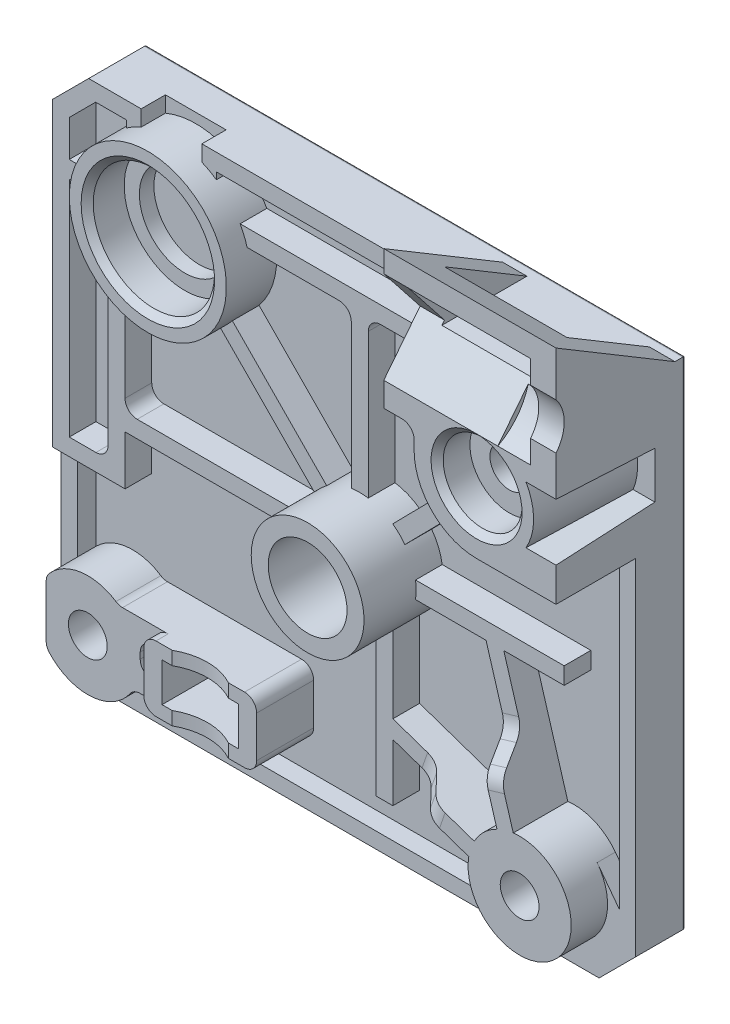
from build123d import *
from build123d.topology import SkipClean

# Parameters (mm, degrees)
SKETCH_1_W                  = 47.38
SKETCH_1_H                  = 43.88
EXTRUDE_1_DEPTH             = 3.2
EXTRUDE_3_DEPTH             = 9
SKETCH_36_W                 = 9.3
SKETCH_36_H                 = 4.1
CUT_EXTRUDE_15_DEPTH        = 3.6
SKETCH_8_R                  = 1.6
CUT_EXTRUDE_4_DEPTH         = 16.67
SKETCH_9_R                  = 1.6
EXTRUDE_4_DEPTH             = 7.45
EXTRUDE_4_DIRECTION_2_REACH = 34.548
CUT_EXTRUDE_16_DEPTH        = 14.2
SKETCH_10_R                 = 3.25
CUT_EXTRUDE_5_DEPTH         = 2.7
EXTRUDE_START               = 3.1
SKETCH_15_R                 = 4.25
SKETCH_15_R_2               = 1.6
EXTRUDE_5_DEPTH             = 3.1
SKETCH_17_R                 = 4.65
EXTRUDE_6_DEPTH             = 5.9
SKETCH_18_R                 = 6.475
EXTRUDE_7_DEPTH             = 3.55
EXTRUDE_START_2             = 0.8
SKETCH_38_R                 = 4.25
SKETCH_38_R_2               = 1.6
EXTRUDE_8_DEPTH             = 0.8
EXTRUDE_START_3             = 1.6
SKETCH_39_R                 = 1.6
EXTRUDE_9_DEPTH             = 1.6
SKETCH_19_R                 = 5
CUT_EXTRUDE_11_DEPTH        = 3.05
SKETCH_20_R                 = 3.75
CUT_EXTRUDE_12_DEPTH        = 1.2
CHAMFER_2_SIZE              = 0.5
CHAMFER_3_SIZE              = 3
FILLET_4_R                  = 1
SKETCH_23_R                 = 2.925
CUT_EXTRUDE_14_DEPTH        = 2.85
SKETCH_40_R                 = 3.25
CUT_EXTRUDE_17_DEPTH        = 38.648667971
CUT_EXTRUDE_18_DEPTH        = 12.1
SKETCH_43_W                 = 10.1
SKETCH_43_H                 = 4.07
CUT_EXTRUDE_19_DEPTH        = 39.053051126
SKETCH_45_R                 = 3
CUT_EXTRUDE_20_DEPTH        = 55.194990543
CUT_EXTRUDE_21_DEPTH        = 2.7
CUT_EXTRUDE_22_DEPTH        = 8.15
DRAFT_1_ANGLE               = 3
CUT_EXTRUDE_START           = -3.95
CUT_EXTRUDE_23_DEPTH        = 3.95
CUT_EXTRUDE_START_2         = -2.2
CUT_EXTRUDE_24_DEPTH        = 2.2
FILLET_5_R                  = 1
SKETCH_50_W                 = 6.3
SKETCH_50_H                 = 3.2
CUT_EXTRUDE_25_DEPTH        = 4.7
CUT_EXTRUDE_26_DEPTH        = 3.7
CUT_EXTRUDE_START_3         = -0.7
CUT_EXTRUDE_27_DEPTH        = 0.7
EXTRUDE_11_DEPTH            = 1.4
EXTRUDE_12_DEPTH            = 1.4
FILLET_6_R                  = 2
FILLET_7_R                  = 0.2
EXTRUDE_13_DEPTH            = 0.15
EXTRUDE_14_DEPTH            = 0.15
CUT_EXTRUDE_28_DEPTH        = 4.8
SKETCH_58_R                 = 1.6
CUT_EXTRUDE_29_DEPTH        = 38.3557519


with BuildPart() as part:
    # Эскиз1 → Бобышка-Вытянуть1 (new body)
    with BuildSketch(Plane.XY):
        Rectangle(SKETCH_1_W, SKETCH_1_H)
    extrude(amount=EXTRUDE_1_DEPTH)

    # Эскиз3 → Бобышка-Вытянуть3 (add)
    with BuildSketch(Plane.XZ.offset(21.94)):
        with BuildLine():
            Line((-13.64, 0), (-13.64, 7.3))
            Line((-13.64, 7.3), (-11.313790008, 7.3))
            ThreePointArc((-11.313790008, 7.3), (-8.99, 6.7), (-6.666209992, 7.3))
            Line((-6.666209992, 7.3), (-4.34, 7.3))
            Line((-4.34, 7.3), (-4.34, 0))
            Line((-4.34, 0), (-13.64, 0))
        make_face()
    extrude(amount=-EXTRUDE_3_DEPTH)

    # Эскиз36 → Вырез-Вытянуть15 (cut)
    with BuildSketch(Plane.XZ.offset(21.94)):
        with Locations((-8.99, 5.25)):
            Rectangle(SKETCH_36_W, SKETCH_36_H)
    extrude(amount=-CUT_EXTRUDE_15_DEPTH, mode=Mode.SUBTRACT)

    # Эскиз8 → Вырез-Вытянуть4 (cut)
    with BuildSketch(Plane.XY.offset(3.2)):
        with Locations((-19.26, -16.34)):
            Circle(SKETCH_8_R)
        with Locations((17.14, -16.34)):
            Circle(SKETCH_8_R)
        with Locations((17.14, 14.66)):
            Circle(SKETCH_8_R)
    extrude(amount=-CUT_EXTRUDE_4_DEPTH, mode=Mode.SUBTRACT)

    # Эскиз9 → Бобышка-Вытянуть4 (add)
    with BuildSketch(Plane.XY.offset(3.2)):
        with BuildLine():
            Line((17.14, 9.51), (23.69, 9.51))
            Line((23.69, 9.51), (23.69, 27.81))
            Line((23.69, 27.81), (9.49, 27.81))
            Line((9.49, 27.81), (9.49, 16.41))
            Line((9.49, 16.41), (10.99, 16.41))
            ThreePointArc((10.99, 16.41), (11.697106781, 16.117106781), (11.99, 15.41))
            Line((11.99, 15.41), (11.99, 14.66))
            ThreePointArc((11.99, 14.66), (13.498400077, 11.018400077), (17.14, 9.51))
        make_face()
        with Locations((17.14, 14.66)):
            Circle(SKETCH_9_R, mode=Mode.SUBTRACT)
    extrude(amount=EXTRUDE_4_DEPTH)

    # Бобышка-Вытянуть4 direction 2: up to this face of the body (flat: up to its plane)
    extrude_4_direction_2_end = Plane(part.part.faces().sort_by_distance((-0.058785147, 0.070526521, 0))[0])
    # Эскиз9 → Бобышка-Вытянуть4 direction 2 (add, up to the picked face)
    with BuildSketch(Plane.XY.offset(3.2), mode=Mode.PRIVATE) as extrude_4_direction_2_sk1:
        with BuildLine():
            Line((17.14, 9.51), (23.69, 9.51))
            Line((23.69, 9.51), (23.69, 27.81))
            Line((23.69, 27.81), (9.49, 27.81))
            Line((9.49, 27.81), (9.49, 16.41))
            Line((9.49, 16.41), (10.99, 16.41))
            ThreePointArc((10.99, 16.41), (11.697106781, 16.117106781), (11.99, 15.41))
            Line((11.99, 15.41), (11.99, 14.66))
            ThreePointArc((11.99, 14.66), (13.498400077, 11.018400077), (17.14, 9.51))
        make_face()
        with Locations((17.14, 14.66)):
            Circle(SKETCH_9_R, mode=Mode.SUBTRACT)
    extrude_4_direction_2_tool1 = split(extrude(extrude_4_direction_2_sk1.sketch, amount=-EXTRUDE_4_DIRECTION_2_REACH, mode=Mode.PRIVATE), bisect_by=extrude_4_direction_2_end, keep=Keep.BOTH, mode=Mode.PRIVATE)
    add(extrude_4_direction_2_tool1.solids().sort_by(Axis((17.092373, 19.426057, 3.2), (0, 0, -1)))[0])

    # Эскиз37 → Вырез-Вытянуть16 (cut)
    with BuildSketch(Plane(origin=(23.69, 0, 0), x_dir=(0, 0, -1), z_dir=(1, 0, 0))):
        Polygon((-10.65, 27.81), (-0.85, 21.94), (0, 21.94), (0, 27.81), align=None)
    extrude(amount=-CUT_EXTRUDE_16_DEPTH, mode=Mode.SUBTRACT)

    # Эскиз10 → Вырез-Вытянуть5 (cut)
    with BuildSketch(Plane.XY.offset(10.65)):
        with Locations((17.14, 14.66)):
            Circle(SKETCH_10_R)
    extrude(amount=-CUT_EXTRUDE_5_DEPTH, mode=Mode.SUBTRACT)

    # Эскиз15 → Бобышка-Вытянуть5 (add)
    # profile 1 of 2: a face of its own
    with BuildSketch(Plane.XY.offset(3.2).offset(EXTRUDE_START)):
        with Locations(Location((17.14, -16.34, 0), (0, 0, 180))):
            Circle(SKETCH_15_R)
        with Locations(Location((17.14, -16.34, 0), (0, 0, 180))):
            Circle(SKETCH_15_R_2, mode=Mode.SUBTRACT)
    # profile 2 of 2: a face of its own
    with BuildSketch(Plane.XY.offset(3.2).offset(EXTRUDE_START)):
        with BuildLine():
            Line((-16.71, -12.94), (-13.64, -12.94))
            Line((-13.64, -12.94), (-13.64, -18.34))
            Line((-13.64, -18.34), (-15.51, -18.34))
            ThreePointArc((-15.51, -18.34), (-18.95917105, -20.5793398), (-22.69, -18.849501943))
            Line((-22.69, -18.849501943), (-22.69, -13.830498057))
            ThreePointArc((-22.69, -13.830498057), (-19.885976595, -12.136352381), (-16.71, -12.94))
        make_face()
        with Locations(Location((-19.26, -16.34, 0), (0, 0, 180))):
            Circle(SKETCH_15_R_2, mode=Mode.SUBTRACT)
    extrude(amount=-EXTRUDE_5_DEPTH)

    # Эскиз17 → Бобышка-Вытянуть6 (add)
    with BuildSketch(Plane.XY.offset(3.2)):
        with Locations(Location((1.66, -1.09, 0), (0, 0, 180))):
            Circle(SKETCH_17_R)
    extrude(amount=EXTRUDE_6_DEPTH)

    # Эскиз18 → Бобышка-Вытянуть7 (add)
    with BuildSketch(Plane.XY.offset(3.2)):
        with Locations(Location((-13.86, 14.66, 0), (0, 0, 180))):
            Circle(SKETCH_18_R)
    extrude(amount=EXTRUDE_7_DEPTH)

    # Эскиз38 → Бобышка-Вытянуть8 (add)
    with BuildSketch(Plane.XY.offset(6.3).offset(EXTRUDE_START_2)):
        with Locations(Location((17.14, -16.34, 0), (0, 0, 180))):
            Circle(SKETCH_38_R)
        with Locations(Location((17.14, -16.34, 0), (0, 0, 180))):
            Circle(SKETCH_38_R_2, mode=Mode.SUBTRACT)
    extrude(amount=-EXTRUDE_8_DEPTH)

    # Эскиз39 → Бобышка-Вытянуть9 (add)
    # profile 1 of 2: a face of its own
    with BuildSketch(Plane.XY.offset(3.2).offset(EXTRUDE_START_3)):
        with Locations((17.14, 14.66)):
            Circle(SKETCH_39_R)
    # profile 2 of 2: a face of its own
    with BuildSketch(Plane.XY.offset(3.2).offset(EXTRUDE_START_3)):
        with BuildLine():
            Line((9.49, 16.41), (9.49, 21.94))
            Line((9.49, 21.94), (-23.69, 21.94))
            Line((-23.69, 21.94), (-23.69, -21.94))
            Line((-23.69, -21.94), (23.69, -21.94))
            Line((23.69, -21.94), (23.69, 9.51))
            Line((23.69, 9.51), (17.14, 9.51))
            ThreePointArc((17.14, 9.51), (13.498400077, 11.018400077), (11.99, 14.66))
            Line((11.99, 14.66), (11.99, 15.41))
            ThreePointArc((11.99, 15.41), (11.697106781, 16.117106781), (10.99, 16.41))
            Line((10.99, 16.41), (9.49, 16.41))
        make_face()
        with Locations(Location((17.14, -16.34, 0), (0, 0, 180))):
            Circle(SKETCH_39_R, mode=Mode.SUBTRACT)
        with Locations(Location((-19.26, -16.34, 0), (0, 0, 180))):
            Circle(SKETCH_39_R, mode=Mode.SUBTRACT)
    extrude(amount=-EXTRUDE_9_DEPTH)

    # Эскиз19 → Вырез-Вытянуть11 (cut)
    with BuildSketch(Plane.XY.offset(6.75)):
        with Locations((-13.86, 14.66)):
            Circle(SKETCH_19_R)
    extrude(amount=-CUT_EXTRUDE_11_DEPTH, mode=Mode.SUBTRACT)

    # Эскиз20 → Вырез-Вытянуть12 (cut)
    with BuildSketch(Plane.XY.offset(3.7)):
        with Locations((-13.86, 14.66)):
            Circle(SKETCH_20_R)
    extrude(amount=-CUT_EXTRUDE_12_DEPTH, mode=Mode.SUBTRACT)

    # Фаска2
    chamfer_2_edges = [part.edges().sort_by_distance(p)[0] for p in [
        (13.89, 14.66, 10.65),
        (-18.86, 14.66, 6.75),
    ]]
    chamfer(chamfer_2_edges, length=CHAMFER_2_SIZE)

    # Фаска3
    chamfer_3_edges = [part.edges().sort_by_distance(p)[0] for p in [
        (23.69, -21.94, 2.4),
        (-23.69, -21.94, 2.4),
        (-23.69, 21.94, 2.4),
    ]]
    chamfer(chamfer_3_edges, length=CHAMFER_3_SIZE)

    # Скругление4
    fillet_4_edges = [part.edges().sort_by_distance(p)[0] for p in [
        (-13.64, -18.34, 6.8),
        (-15.51, -18.34, 5.55),
        (-16.71, -12.94, 5.55),
        (-22.69, -13.830498057, 5.55),
        (-22.69, -18.849501943, 5.55),
        (-13.64, -12.94, 6.8),
        (-4.34, -12.94, 6.05),
        (-4.34, -18.34, 6.05),
    ]]
    fillet(fillet_4_edges, radius=FILLET_4_R)

    # Эскиз23 → Вырез-Вытянуть14 (cut)
    with BuildSketch(Plane(origin=(0, 0, 0), x_dir=(-1, 0, 0), z_dir=(0, 0, -1))):
        with Locations((-17.14, 14.66)):
            Circle(SKETCH_23_R)
        with Locations((-17.14, -16.34)):
            Circle(SKETCH_23_R)
        with Locations((19.26, -16.34)):
            Circle(SKETCH_23_R)
    extrude(amount=-CUT_EXTRUDE_14_DEPTH, mode=Mode.SUBTRACT)

    # Эскиз40 → Вырез-Вытянуть17 (cut, through all)
    with BuildSketch(Plane.XY.offset(9.1)):
        with Locations((1.66, -1.09)):
            Circle(SKETCH_40_R)
    extrude(amount=-CUT_EXTRUDE_17_DEPTH, mode=Mode.SUBTRACT)

    # Эскиз42 → Вырез-Вытянуть18 (cut)
    with BuildSketch(Plane.ZY.offset(-9.49)):
        Polygon((10.65, 26.01), (7.65, 22.21), (10.65, 18.41), align=None)
    extrude(amount=-CUT_EXTRUDE_18_DEPTH, mode=Mode.SUBTRACT)

    # Эскиз43 → Вырез-Вытянуть19 (cut, through all)
    with BuildSketch(Plane.XY.offset(10.65)):
        with Locations((16.54, 23.975)):
            Rectangle(SKETCH_43_W, SKETCH_43_H)
    extrude(amount=-CUT_EXTRUDE_19_DEPTH, mode=Mode.SUBTRACT)

    # Эскиз45 → Вырез-Вытянуть20 (cut, through all)
    with BuildSketch(Plane.ZY.offset(-21.59)):
        with Locations((12.971637353, 22.21)):
            Circle(SKETCH_45_R)
    extrude(amount=-CUT_EXTRUDE_20_DEPTH, mode=Mode.SUBTRACT)

    # Эскиз46 → Вырез-Вытянуть21 (cut)
    with BuildSketch(Plane.ZY.offset(-21.59)):
        with BuildLine():
            Line((8.145715431, 21.582093788), (10.65, 18.41))
            ThreePointArc((10.65, 18.41), (9.063078847, 19.731747787), (8.145715431, 21.582093788))
        make_face()
    extrude(amount=CUT_EXTRUDE_21_DEPTH, mode=Mode.SUBTRACT)

    # Эскиз47 → Вырез-Вытянуть22 (cut)
    with BuildSketch(Plane.XY.offset(10.65)):
        with BuildLine():
            Line((21.210319398, 12.31), (23.69, 12.31))
            Line((23.69, 12.31), (23.69, 17.01))
            Line((23.69, 17.01), (21.210319398, 17.01))
            ThreePointArc((21.210319398, 17.01), (21.84, 14.66), (21.210319398, 12.31))
        make_face()
    extrude(amount=-CUT_EXTRUDE_22_DEPTH, mode=Mode.SUBTRACT)

    # Уклон1
    draft_1_faces = [part.faces().sort_by_distance(p)[0] for p in [
        (22.450159699, 17.01, 6.575),
        (21.84, 14.66, 6.575),
        (22.450159699, 12.31, 6.575),
    ]]
    draft(draft_1_faces, Plane.XY.offset(10.65), DRAFT_1_ANGLE)

    # Эскиз48 → Вырез-Вытянуть23 (cut)
    with BuildSketch(Plane.XY.offset(6.75).offset(CUT_EXTRUDE_START)):
        with BuildLine():
            Line((-16.36, 20.632907583), (-16.36, 21.94))
            Line((-16.36, 21.94), (-11.36, 21.94))
            Line((-11.36, 21.94), (-11.36, 20.632907583))
            ThreePointArc((-11.36, 20.632907583), (-13.86, 21.135), (-16.36, 20.632907583))
        make_face()
    extrude(amount=CUT_EXTRUDE_23_DEPTH, mode=Mode.SUBTRACT)

    # Эскиз49 → Вырез-Вытянуть24 (cut)
    with SkipClean():  # the faces are left unmerged after this step: merging them gives an invalid solid
        with BuildSketch(Plane.XY.offset(4.8).offset(CUT_EXTRUDE_START_2)):
            with BuildLine():
                Line((-17.56, 20.54), (-17.56, 19.973720448))
                ThreePointArc((-17.56, 19.973720448), (-19.428801901, 17.963645016), (-20.297050955, 15.36))
                Line((-20.297050955, 15.36), (-22.29, 15.36))
                Line((-22.29, 15.36), (-22.29, 18.360101013))
                Line((-22.29, 18.360101013), (-20.110101013, 20.54))
                Line((-20.110101013, 20.54), (-17.56, 20.54))
            make_face()
            with BuildLine():
                Line((-10.16, 20.54), (-10.16, 19.973720448))
                ThreePointArc((-10.16, 19.973720448), (-9.057980202, 19.003527468), (-8.202869544, 17.81))
                Line((-8.202869544, 17.81), (9.49, 17.81))
                Line((9.49, 17.81), (9.49, 18.41))
                Line((9.49, 18.41), (9.49, 20.54))
                Line((9.49, 20.54), (-10.16, 20.54))
            make_face()
            with BuildLine():
                Line((-22.29, 13.96), (-20.297050955, 13.96))
                ThreePointArc((-20.297050955, 13.96), (-19.898178731, 12.322047347), (-19.09, 10.84257613))
                Line((-19.09, 10.84257613), (-19.09, -4.46))
                Line((-19.09, -4.46), (-22.29, -4.46))
                Line((-22.29, -4.46), (-22.29, 13.96))
            make_face()
            with BuildLine():
                Line((-22.29, -5.86), (-17.69, -5.86))
                Line((-17.69, -5.86), (-17.69, -1.79))
                Line((-17.69, -1.79), (-2.937009898, -1.79))
                ThreePointArc((-2.937009898, -1.79), (-0.828921486, -5.017819985), (2.99, -5.545737874))
                Line((2.99, -5.545737874), (2.99, -17.44))
                Line((2.99, -17.44), (4.39, -17.44))
                Line((4.39, -17.44), (4.39, -12.712374818))
                Line((4.39, -12.712374818), (12.947419248, -15.643748151))
                ThreePointArc((12.947419248, -15.643748151), (13.31577668, -18.194134838), (15.09, -20.062902094))
                Line((15.09, -20.062902094), (15.09, -20.64))
                Line((15.09, -20.64), (-15.69, -20.64))
                Line((-15.69, -20.64), (-15.69, -18.665661085))
                ThreePointArc((-15.69, -18.665661085), (-15.355100682, -18.425030352), (-14.951578015, -18.34))
                Line((-14.951578015, -18.34), (-12.64, -18.34))
                Line((-12.64, -18.34), (-11.313790008, -18.34))
                Line((-11.313790008, -18.34), (-6.666209992, -18.34))
                Line((-6.666209992, -18.34), (-5.34, -18.34))
                ThreePointArc((-5.34, -18.34), (-4.632893219, -18.047106781), (-4.34, -17.34))
                Line((-4.34, -17.34), (-4.34, -13.94))
                ThreePointArc((-4.34, -13.94), (-4.632893219, -13.232893219), (-5.34, -12.94))
                Line((-5.34, -12.94), (-6.666209992, -12.94))
                Line((-6.666209992, -12.94), (-11.313790008, -12.94))
                Line((-11.313790008, -12.94), (-12.64, -12.94))
                Line((-12.64, -12.94), (-16.395999302, -12.94))
                ThreePointArc((-16.395999302, -12.94), (-16.680520621, -12.898669713), (-16.941523244, -12.778095238))
                ThreePointArc((-16.941523244, -12.778095238), (-19.719522634, -12.11491551), (-22.29, -13.359798665))
                Line((-22.29, -13.359798665), (-22.29, -5.86))
            make_face()
            with BuildLine():
                Line((-2.065182593, 1.693076472), (-9.840520732, 9.583641915))
                ThreePointArc((-9.840520732, 9.583641915), (-13.740872867, 8.186095944), (-17.69, 9.439202647))
                Line((-17.69, 9.439202647), (-17.69, -0.39))
                Line((-17.69, -0.39), (-2.937009898, -0.39))
                ThreePointArc((-2.937009898, -0.39), (-2.629466617, 0.705264922), (-2.065182593, 1.693076472))
            make_face()
            with BuildLine():
                Line((22.39, 9.51), (17.14, 9.51))
                ThreePointArc((17.14, 9.51), (15.518983825, 9.771768565), (14.062756418, 10.530463472))
                Line((14.062756418, 10.530463472), (5.381588886, 1.697880227))
                ThreePointArc((5.381588886, 1.697880227), (5.948307637, 0.708031592), (6.257009898, -0.39))
                Line((6.257009898, -0.39), (18.51, -0.39))
                Line((18.51, -0.39), (18.51, -1.79))
                Line((18.51, -1.79), (13.531465913, -1.79))
                Line((13.531465913, -1.79), (16.612845635, -12.122819867))
                ThreePointArc((16.612845635, -12.122819867), (18.794418481, -12.42523315), (20.531694542, -13.778963465))
                Line((20.531694542, -13.778963465), (22.39, -16.24))
                Line((22.39, -16.24), (22.39, 9.51))
            make_face()
            with BuildLine():
                Line((11.99, 14.66), (11.99, 15.41))
                ThreePointArc((11.99, 15.41), (11.697106781, 16.117106781), (10.99, 16.41))
                Line((10.99, 16.41), (9.49, 16.41))
                Line((9.49, 16.41), (2.36, 16.41))
                Line((2.36, 16.41), (2.36, 3.507009898))
                ThreePointArc((2.36, 3.507009898), (3.420891079, 3.213691742), (4.383118066, 2.679234405))
                Line((4.383118066, 2.679234405), (13.064285598, 11.511817649))
                ThreePointArc((13.064285598, 11.511817649), (12.265965266, 12.996784616), (11.99, 14.66))
            make_face()
            with BuildLine():
                Line((-7.625970404, 16.41), (0.96, 16.41))
                Line((0.96, 16.41), (0.96, 3.507009898))
                ThreePointArc((0.96, 3.507009898), (-0.103666933, 3.212554933), (-1.067978706, 2.675718017))
                Line((-1.067978706, 2.675718017), (-8.843316844, 10.56628346))
                ThreePointArc((-8.843316844, 10.56628346), (-7.521081314, 13.339494455), (-7.625970404, 16.41))
            make_face()
            with BuildLine():
                Line((4.39, -11.232512665), (13.401113347, -14.319300468))
                ThreePointArc((13.401113347, -14.319300468), (14.195817789, -13.274989215), (15.271230733, -12.522906678))
                Line((15.271230733, -12.522906678), (12.070539981, -1.79))
                Line((12.070539981, -1.79), (6.257009898, -1.79))
                ThreePointArc((6.257009898, -1.79), (5.630979727, -3.509466885), (4.39, -4.854252914))
                Line((4.39, -4.854252914), (4.39, -11.232512665))
            make_face()
        extrude(amount=CUT_EXTRUDE_24_DEPTH, mode=Mode.SUBTRACT)

    # Скругление5
    fillet_5_edges = [part.edges().sort_by_distance(p)[0] for p in [
        (-19.09, -4.46, 3.7),
        (0.96, 16.41, 3.7),
        (2.36, 16.41, 3.7),
        (-17.69, -0.39, 3.7),
    ]]
    fillet(fillet_5_edges, radius=FILLET_5_R)

    # Эскиз50 → Вырез-Вытянуть25 (cut)
    with SkipClean():  # the faces are left unmerged after this step: merging them gives an invalid solid
        with BuildSketch(Plane.XY.offset(7.3)):
            with Locations((-8.99, -15.64)):
                Rectangle(SKETCH_50_W, SKETCH_50_H)
        extrude(amount=-CUT_EXTRUDE_25_DEPTH, mode=Mode.SUBTRACT)

    # Эскиз51 → Вырез-Вытянуть26 (cut)
    with SkipClean():  # the faces are left unmerged after this step: merging them gives an invalid solid
        with BuildSketch(Plane.XY.offset(6.3)):
            with BuildLine():
                Line((-13.64, -16.89), (-13.94, -16.89))
                ThreePointArc((-13.94, -16.89), (-14.647106781, -16.597106781), (-14.94, -15.89))
                Line((-14.94, -15.89), (-14.94, -15.39))
                ThreePointArc((-14.94, -15.39), (-14.647106781, -14.682893219), (-13.94, -14.39))
                Line((-13.94, -14.39), (-13.64, -14.39))
                Line((-13.64, -14.39), (-13.64, -16.89))
            make_face()
        extrude(amount=-CUT_EXTRUDE_26_DEPTH, mode=Mode.SUBTRACT)

    # Эскиз52 → Вырез-Вытянуть27 (cut)
    with SkipClean():  # the faces are left unmerged after this step: merging them gives an invalid solid
        with BuildSketch(Plane.XY.offset(4.8).offset(CUT_EXTRUDE_START_3)):
            with BuildLine():
                Line((-22.29, -5.86), (-23.69, -5.86))
                Line((-23.69, -5.86), (-23.69, -18.94))
                Line((-23.69, -18.94), (-20.69, -21.94))
                Line((-20.69, -21.94), (20.69, -21.94))
                Line((20.69, -21.94), (23.69, -18.94))
                Line((23.69, -18.94), (23.69, 9.51))
                Line((23.69, 9.51), (22.39, 9.51))
                Line((22.39, 9.51), (22.39, -16.24))
                Line((22.39, -16.24), (20.531694542, -13.778963465))
                ThreePointArc((20.531694542, -13.778963465), (20.352788078, -19.122174108), (15.09, -20.062902094))
                Line((15.09, -20.062902094), (15.09, -20.64))
                Line((15.09, -20.64), (-15.69, -20.64))
                Line((-15.69, -20.64), (-15.69, -18.665661085))
                ThreePointArc((-15.69, -18.665661085), (-15.732811275, -18.715760788), (-15.772229822, -18.768571429))
                ThreePointArc((-15.772229822, -18.768571429), (-19.009457596, -20.582608691), (-22.437692308, -19.162192693))
                ThreePointArc((-22.437692308, -19.162192693), (-22.624797387, -18.853328781), (-22.69, -18.498147354))
                Line((-22.69, -18.498147354), (-22.69, -14.181852646))
                ThreePointArc((-22.69, -14.181852646), (-22.624797387, -13.826671219), (-22.437692308, -13.517807307))
                ThreePointArc((-22.437692308, -13.517807307), (-22.364851467, -13.437863309), (-22.29, -13.359798665))
                Line((-22.29, -13.359798665), (-22.29, -5.86))
            make_face()
        extrude(amount=CUT_EXTRUDE_27_DEPTH, mode=Mode.SUBTRACT)

    # Эскиз53 → Бобышка-Вытянуть11 (add)
    with SkipClean():  # the faces are left unmerged after this step: merging them gives an invalid solid
        with BuildSketch(Plane(origin=(-3.436306486, -10.031446672, 0), x_dir=(0.946034059096539, -0.32406721375252706, 0), z_dir=(-0.32406721375252706, -0.9460340590965391, 0))):
            Polygon((17.560282046, 7.1), (13.945539434, 7.1), (11.645539434, 4.8), (17.560282046, 4.8), align=None)
        extrude(amount=-EXTRUDE_11_DEPTH)

    # Эскиз54 → Бобышка-Вытянуть12 (add)
    with SkipClean():  # the faces are left unmerged after this step: merging them gives an invalid solid
        with BuildSketch(Plane(origin=(10.594555532, 3.159432662, 0), x_dir=(0, 0, 1), z_dir=(-0.958296358100307, -0.28577629371886004, 0))):
            Polygon((4.8, -10.696768166), (7.1, -12.996768166), (7.1, -16.606768166), (4.8, -16.606768166), align=None)
        extrude(amount=-EXTRUDE_12_DEPTH)

    # Скругление6
    fillet_6_edges = [part.edges().sort_by_distance(p)[0] for p in [
        (7.807617506, -13.143160348, 4.8),
        (9.983495842, -13.888514939, 7.1),
        (14.322245744, -6.891197909, 4.8),
        (14.979531219, -9.095279533, 7.1),
    ]]
    fillet(fillet_6_edges, radius=FILLET_6_R)

    # Скругление7
    fillet_7_edges = [part.edges().sort_by_distance(p)[0] for p in [
        (-23.69, 0, 0),
        (23.69, 1.5, 0),
        (0, -21.94, 0),
        (22.19, -20.44, 0),
        (-22.19, -20.44, 0),
        (-22.19, 20.44, 0),
        (20.065, 14.66, 0),
        (20.065, -16.34, 0),
        (-16.335, -16.34, 0),
        (-1.59, -1.09, 0),
        (1.5, 21.94, 0),
    ]]
    fillet(fillet_7_edges, radius=FILLET_7_R)

    # Эскиз55 → Бобышка-Вытянуть13 (add)
    with SkipClean():  # the faces are left unmerged after this step: merging them gives an invalid solid
        with BuildSketch(Plane(origin=(0, 0, 0), x_dir=(-1, 0, 0), z_dir=(0, 0, -1))):
            with BuildLine():
                Line((7.201443973, 18.111612903), (5.603390526, 18.94))
                ThreePointArc((5.603390526, 18.94), (6.901551726, 8.489911053), (17.1212, 5.950546828))
                Line((17.1212, 5.950546828), (17.682266667, 4.452146282))
                Line((17.682266667, 4.452146282), (19.815476394, 8.736124502))
                Line((19.815476394, 8.736124502), (15.928933333, 9.134647987))
                Line((15.928933333, 9.134647987), (16.49, 7.636247442))
                ThreePointArc((16.49, 7.636247442), (8.248348166, 9.684121817), (7.201443973, 18.111612903))
            make_face()
            Polygon((8.09, -3.94), (9.89, -3.94), (9.89, -13.74), (10.99, -13.74), (8.99, -17.24), (6.99, -13.74), (8.09, -13.74), align=None)
        extrude(amount=EXTRUDE_13_DEPTH)

    # Эскиз56 → Бобышка-Вытянуть14 (add)
    # profile 1 of 7: a face of its own
    with SkipClean():  # the faces are left unmerged after this step: merging them gives an invalid solid
        with BuildSketch(Plane(origin=(0, 0, 0), x_dir=(-1, 0, 0), z_dir=(0, 0, -1))):
            Polygon((-0.272580337, 16.664299701), (2.700977355, 16.471992008), (2.55854947, 14.267064124), (2.055544663, 14.299516047), (2.159511009, 15.904083354), (1.500256201, 15.946751624), (1.403501394, 14.453963162), (0.90229947, 14.486415085), (0.999054278, 15.979203547), (0.190160047, 16.031487201), (0.082587932, 14.370429508), (-0.418613991, 14.402881431), align=None)
        # profile 2 of 7: a face of its own
        with BuildSketch(Plane(origin=(0, 0, 0), x_dir=(-1, 0, 0), z_dir=(0, 0, -1))):
            Polygon((-0.355390943, 13.106725926), (1.37597925, 12.427639388), (2.582710019, 13.622951888), (2.726339827, 12.934249965), (1.91143598, 12.152999965), (2.968527327, 11.775596119), (3.111556173, 11.092903811), (1.504585019, 11.704682657), (0.21191675, 10.39338458), (0.06347925, 11.10432208), (0.937277327, 11.961894196), (-0.207554404, 12.399995157), align=None)
        # profile 3 of 7: a face of its own
        with BuildSketch(Plane(origin=(0, 0, 0), x_dir=(-1, 0, 0), z_dir=(0, 0, -1))):
            Polygon((1.018880297, 8.490544302), (3.214793759, 9.604726995), (2.81695722, 10.388981802), (3.264072605, 10.615544302), (4.329577413, 8.515183725), (3.882462028, 8.288621225), (3.485226451, 9.071073148), (1.28931299, 7.956890456), align=None)
        # profile 4 of 7: a face of its own
        with BuildSketch(Plane(origin=(0, 0, 0), x_dir=(-1, 0, 0), z_dir=(0, 0, -1))):
            with BuildLine():
                Line((2.55576162, 5.948458986), (4.758285659, 7.959276294))
                Line((4.758285659, 7.959276294), (5.613453928, 7.022978217))
                add(Edge.make_bspline(
                    [(5.613453928, 7.022978217), (5.639225199, 6.994448876), (5.688999515, 6.939347658), (5.758833843, 6.857823263), (5.820573367, 6.78016082), (5.875882482, 6.70743109), (5.923049316, 6.638423149), (5.963879955, 6.574270611), (5.996456534, 6.513960901), (6.022495338, 6.457229701), (6.041687403, 6.402146606), (6.057454449, 6.347751744), (6.066545806, 6.292264033), (6.072250739, 6.236263046), (6.072819221, 6.179539903), (6.068311354, 6.122331322), (6.060260763, 6.06432843), (6.046054779, 6.006423187), (6.028360906, 5.94886298), (6.005802805, 5.893023698), (5.980249481, 5.838400172), (5.948985729, 5.786321518), (5.915221293, 5.734999902), (5.876069023, 5.686264586), (5.833872668, 5.638545996), (5.802408859, 5.609267728), (5.786530851, 5.59449264)],
                    knots=[0, 0, 0, 0, 1.673972567, 3.23308995, 4.672926, 5.993479632, 7.210416783, 8.311567336, 9.302841548, 10.192898351, 11.026046873, 11.840774621, 12.655268889, 13.47023005, 14.290170322, 15.121032859, 15.967228432, 16.836747852, 17.714019715, 18.587031897, 19.457032403, 20.336642622, 21.229302623, 22.129727059, 23.056178877, 24, 24, 24, 24], degree=3))
                add(Edge.make_bspline(
                    [(5.786530851, 5.59449264), (5.766004355, 5.576289536), (5.725709769, 5.54055589), (5.66102141, 5.494220604), (5.594987593, 5.455145325), (5.527632684, 5.422911966), (5.458924151, 5.397414178), (5.388419308, 5.379329115), (5.316520574, 5.368701198), (5.243484006, 5.364128072), (5.169559524, 5.367931493), (5.094956091, 5.379260238), (5.020342271, 5.399731443), (4.944709919, 5.426641984), (4.86905769, 5.46242907), (4.793128626, 5.506135912), (4.716602014, 5.557063759), (4.667464534, 5.596123731), (4.642300082, 5.616127256)],
                    knots=[0, 0, 0, 0, 1.038186414, 2.038014217, 3.007076984, 3.939997786, 4.861440821, 5.777530679, 6.690349451, 7.609604895, 8.543604129, 9.487558543, 10.460767687, 11.468389748, 12.523612965, 13.624276291, 14.783336378, 16, 16, 16, 16], degree=3))
                add(Edge.make_bspline(
                    [(4.642300082, 5.616127256), (4.649413661, 5.580153466), (4.663296889, 5.509945165), (4.675217039, 5.405671146), (4.679589211, 5.30586233), (4.676930422, 5.224088165), (4.669257358, 5.157304053), (4.661659108, 5.100888593), (4.649753588, 5.038315942), (4.636265791, 4.968840554), (4.618445205, 4.893227834), (4.598151118, 4.811054831), (4.574483191, 4.722362585), (4.557425612, 4.661182238), (4.548550082, 4.629348409)],
                    knots=[0, 0, 0, 0, 1.314735092, 2.565904769, 3.759565869, 4.895510516, 5.495306501, 6.169946695, 6.93655365, 7.779115275, 8.708009658, 9.722122611, 10.814757293, 12, 12, 12, 12], degree=3))
                Line((4.548550082, 4.629348409), (4.364054889, 3.968290717))
                Line((4.364054889, 3.968290717), (3.878477966, 4.500141679))
                Line((3.878477966, 4.500141679), (4.064175082, 5.259757063))
                add(Edge.make_bspline(
                    [(4.064175082, 5.259757063), (4.072002589, 5.292004924), (4.086970233, 5.353668811), (4.108099168, 5.441742659), (4.126116614, 5.521076364), (4.141387895, 5.591547832), (4.153167766, 5.65333959), (4.163122499, 5.706336794), (4.169876354, 5.750623795), (4.174702879, 5.797299377), (4.176333044, 5.848146009), (4.172561432, 5.904884787), (4.161541043, 5.957754149), (4.144073647, 6.008876536), (4.116614454, 6.061685744), (4.076425321, 6.118888268), (4.025449914, 6.184613603), (3.985370875, 6.229177793), (3.963814505, 6.253146486)],
                    knots=[0, 0, 0, 0, 1.490303607, 2.849736803, 4.067539731, 5.143874523, 6.087806739, 6.892465726, 7.565511382, 8.099034272, 8.999075114, 9.847074599, 10.646334314, 11.417349217, 12.266302582, 13.309298631, 14.552815723, 16, 16, 16, 16], degree=3))
                Line((3.963814505, 6.253146486), (3.881482774, 6.343290717))
                Line((3.881482774, 6.343290717), (2.96201162, 5.503747448))
                Line((2.96201162, 5.503747448), (2.55576162, 5.948458986))
            make_face()
            with BuildLine():
                Line((4.233045274, 6.664204179), (4.533526043, 6.334877256))
                add(Edge.make_bspline(
                    [(4.533526043, 6.334877256), (4.55692587, 6.309602366), (4.601311696, 6.261659841), (4.665138954, 6.193874608), (4.723272834, 6.134806395), (4.774830662, 6.083152562), (4.821024578, 6.040782299), (4.860816321, 6.005937034), (4.894649491, 5.979542292), (4.931197518, 5.955054975), (4.974751596, 5.93628284), (5.026408436, 5.920986127), (5.079314645, 5.915915633), (5.132970947, 5.918633832), (5.186555513, 5.931630315), (5.239506684, 5.95360807), (5.29122435, 5.985256151), (5.32256472, 6.012472487), (5.338814505, 6.026583986)],
                    knots=[0, 0, 0, 0, 1.664110295, 3.156557891, 4.4979534, 5.66821163, 6.681881364, 7.525882001, 8.222777318, 8.754284129, 9.646567149, 10.501374611, 11.347868609, 12.200921043, 13.085931184, 13.997170681, 14.961545631, 16, 16, 16, 16], degree=3))
                add(Edge.make_bspline(
                    [(5.338814505, 6.026583986), (5.355753221, 6.043548404), (5.388257128, 6.076101628), (5.427254039, 6.130831677), (5.452962064, 6.188939933), (5.466523195, 6.249420332), (5.467433503, 6.311262431), (5.457095357, 6.373895651), (5.433683475, 6.436407641), (5.410371939, 6.475636501), (5.398309697, 6.495934948)],
                    knots=[0, 0, 0, 0, 1.102343739, 2.115300684, 3.073036965, 4.008135746, 4.948809408, 5.902275222, 6.914560501, 8, 8, 8, 8], degree=3))
                add(Edge.make_bspline(
                    [(5.398309697, 6.495934948), (5.393754, 6.502184753), (5.382986729, 6.516956003), (5.36256986, 6.541707646), (5.336532519, 6.573501714), (5.302948787, 6.611314963), (5.263723021, 6.656192832), (5.21780382, 6.707438929), (5.165522264, 6.764951661), (5.128672046, 6.805624755), (5.109247197, 6.827064756)],
                    knots=[0, 0, 0, 0, 0.422064115, 0.997537416, 1.750725435, 2.665150473, 3.757526907, 5.004260535, 6.420856393, 8, 8, 8, 8], degree=3))
                Line((5.109247197, 6.827064756), (4.791939505, 7.174420525))
                Line((4.791939505, 7.174420525), (4.233045274, 6.664204179))
            make_face(mode=Mode.SUBTRACT)
        # profile 5 of 7: a face of its own
        with BuildSketch(Plane(origin=(0, 0, 0), x_dir=(-1, 0, 0), z_dir=(0, 0, -1))):
            with BuildLine():
                Line((7.010748626, 5.638768345), (7.522166895, 5.329874115))
                Line((7.522166895, 5.329874115), (6.694041895, 3.957878922))
                add(Edge.make_bspline(
                    [(6.694041895, 3.957878922), (6.678297868, 3.931907315), (6.648268633, 3.882370595), (6.607251509, 3.810557063), (6.56952824, 3.746547681), (6.537709598, 3.688706011), (6.510827132, 3.63773796), (6.488115042, 3.593977174), (6.47142601, 3.55663418), (6.462031243, 3.534016989), (6.45786401, 3.523984692)],
                    knots=[0, 0, 0, 0, 1.474101808, 2.811615361, 4.014048721, 5.08029423, 6.015453404, 6.811222821, 7.472694642, 8, 8, 8, 8], degree=3))
                add(Edge.make_bspline(
                    [(6.45786401, 3.523984692), (6.449386721, 3.495162992), (6.432728229, 3.438526252), (6.426300363, 3.350297964), (6.436313042, 3.26327062), (6.457107675, 3.192243761), (6.482638897, 3.137594448), (6.506150519, 3.097008788), (6.534615248, 3.057817275), (6.567866854, 3.020081375), (6.605286732, 2.983165805), (6.647580006, 2.947745734), (6.694435329, 2.913525851), (6.727965699, 2.892378289), (6.745123626, 2.881556807)],
                    knots=[0, 0, 0, 0, 1.404161378, 2.759279357, 4.109450445, 5.489930008, 6.203608926, 6.931034261, 7.683681919, 8.468400617, 9.284523683, 10.143535438, 11.050022937, 12, 12, 12, 12], degree=3))
                add(Edge.make_bspline(
                    [(6.745123626, 2.881556807), (6.762803689, 2.871064987), (6.796979894, 2.850783917), (6.849268829, 2.825700373), (6.899346859, 2.8042134), (6.948398636, 2.788792265), (6.995288469, 2.777065664), (7.040560987, 2.770075481), (7.084319517, 2.769116261), (7.139375136, 2.772958072), (7.204285126, 2.78709784), (7.275592884, 2.816018947), (7.339076587, 2.856992762), (7.384387347, 2.901973568), (7.419129703, 2.944279805), (7.447706349, 2.982326724), (7.479771972, 3.025503123), (7.513801882, 3.074629964), (7.54990095, 3.129766134), (7.588935753, 3.19048315), (7.630973238, 3.256766165), (7.6590789, 3.303374366), (7.673609203, 3.327470269)],
                    knots=[0, 0, 0, 0, 1.016472013, 1.964877403, 2.866630555, 3.70962665, 4.505158804, 5.256312982, 5.970063211, 6.665486762, 7.983247396, 9.23642102, 10.454024798, 11.694439534, 12.37703655, 13.161881594, 14.047815215, 15.037414074, 16.117535982, 17.307734049, 18.608129555, 20, 20, 20, 20], degree=3))
                Line((7.673609203, 3.327470269), (8.519162087, 4.728912576))
                Line((8.519162087, 4.728912576), (9.030580357, 4.420018345))
                Line((9.030580357, 4.420018345), (8.227695741, 3.089489499))
                add(Edge.make_bspline(
                    [(8.227695741, 3.089489499), (8.205568864, 3.052964041), (8.1629667, 2.982639449), (8.099793261, 2.882311093), (8.040670677, 2.790893852), (7.984334324, 2.709183886), (7.933166603, 2.635738732), (7.885199685, 2.571874279), (7.840459314, 2.517536644), (7.787221823, 2.457334406), (7.720054726, 2.394485827), (7.635758751, 2.330810577), (7.546752869, 2.280074717), (7.452860923, 2.242451691), (7.354562608, 2.216815139), (7.250691062, 2.204511581), (7.141695685, 2.204343227), (7.047414147, 2.213438255), (6.969485423, 2.228532389), (6.908001269, 2.244122294), (6.844654341, 2.264814961), (6.779221143, 2.290257846), (6.711295808, 2.319799232), (6.640968988, 2.353347042), (6.568772095, 2.391834052), (6.520848558, 2.420416451), (6.496325549, 2.435042384)],
                    knots=[0, 0, 0, 0, 1.411498053, 2.717639368, 3.918708974, 5.009601968, 5.997915684, 6.877216092, 7.648693378, 8.323926752, 9.532437787, 10.681880254, 11.808653453, 12.907853747, 14.015952021, 15.156684508, 16.355141442, 17.612857283, 18.280319712, 18.977278518, 19.708045138, 20.481480455, 21.296991824, 22.155836774, 23.056321058, 24, 24, 24, 24], degree=3))
                add(Edge.make_bspline(
                    [(6.496325549, 2.435042384), (6.467105083, 2.452800996), (6.410388497, 2.487270258), (6.330775508, 2.541833832), (6.25720219, 2.594114735), (6.191411488, 2.646729217), (6.132655203, 2.698459291), (6.079688049, 2.748459439), (6.035370097, 2.799301847), (5.985279708, 2.864197696), (5.934365802, 2.946156221), (5.885627141, 3.045537343), (5.850811185, 3.145645402), (5.829967913, 3.245479114), (5.820855569, 3.34351593), (5.822903911, 3.437951396), (5.833475972, 3.528734341), (5.849543664, 3.586241452), (5.857503433, 3.614729884)],
                    knots=[0, 0, 0, 0, 1.124872054, 2.183363644, 3.174864847, 4.094107068, 4.953505627, 5.750615334, 6.488486184, 7.170071058, 8.446553206, 9.655205295, 10.805833173, 11.924042474, 13.002961712, 14.037982529, 15.028036701, 16, 16, 16, 16], degree=3))
                add(Edge.make_bspline(
                    [(5.857503433, 3.614729884), (5.864865978, 3.636458601), (5.880361034, 3.682188401), (5.909938296, 3.752120823), (5.943264863, 3.828203114), (5.983452445, 3.909236457), (6.028383197, 3.996265119), (6.078876995, 4.088953327), (6.135558044, 4.186592404), (6.175345725, 4.253391283), (6.19584478, 4.287806807)],
                    knots=[0, 0, 0, 0, 0.729290598, 1.534849623, 2.413156536, 3.370359388, 4.410234072, 5.527638172, 6.726211745, 8, 8, 8, 8], degree=3))
                Line((6.19584478, 4.287806807), (7.010748626, 5.638768345))
            make_face()
        # profile 6 of 7: a face of its own
        with BuildSketch(Plane(origin=(0, 0, 0), x_dir=(-1, 0, 0), z_dir=(0, 0, -1))):
            with BuildLine():
                Line((9.849324262, 4.06959449), (10.905814646, 3.791950259))
                add(Edge.make_bspline(
                    [(10.905814646, 3.791950259), (10.934709495, 3.784310881), (10.990689236, 3.769510649), (11.071291177, 3.74515534), (11.146558332, 3.7213174), (11.216041507, 3.697010347), (11.279410858, 3.671497392), (11.337120241, 3.646247744), (11.389655566, 3.621533695), (11.421748717, 3.603053353), (11.437064646, 3.594233913)],
                    knots=[0, 0, 0, 0, 1.261655109, 2.444280917, 3.554188844, 4.594653287, 5.551022598, 6.437175181, 7.254167495, 8, 8, 8, 8], degree=3))
                add(Edge.make_bspline(
                    [(11.437064646, 3.594233913), (11.474229456, 3.569738553), (11.548027069, 3.521098477), (11.645619438, 3.431884898), (11.730282049, 3.330698432), (11.801551292, 3.218141045), (11.859700056, 3.095692996), (11.905180056, 2.964982658), (11.936173157, 2.82624521), (11.950337476, 2.70534788), (11.955266614, 2.604496568), (11.95456861, 2.524647686), (11.949476133, 2.441666095), (11.941258902, 2.355612526), (11.928235046, 2.26648671), (11.91220285, 2.174019512), (11.891688831, 2.078208885), (11.875187133, 2.013651337), (11.866752146, 1.980652183)],
                    knots=[0, 0, 0, 0, 1.186584943, 2.356184173, 3.513794504, 4.698896886, 5.901811995, 7.124327657, 8.385096612, 9.688245353, 10.368028422, 11.079154173, 11.818231884, 12.586459531, 13.385691171, 14.221635796, 15.090973617, 16, 16, 16, 16], degree=3))
                add(Edge.make_bspline(
                    [(11.866752146, 1.980652183), (11.851026142, 1.924069665), (11.820556627, 1.814439667), (11.76167194, 1.660259194), (11.697238383, 1.519571216), (11.644666474, 1.435102235), (11.619155992, 1.394113721)],
                    knots=[0, 0, 0, 0, 1.101604132, 2.134384684, 3.094711463, 4, 4, 4, 4], degree=3))
                add(Edge.make_bspline(
                    [(11.619155992, 1.394113721), (11.60342473, 1.370862925), (11.572417691, 1.32503454), (11.521624176, 1.26111878), (11.46987747, 1.200989687), (11.415692317, 1.145798472), (11.359743686, 1.094614153), (11.302062327, 1.047436431), (11.242110569, 1.005381073), (11.200450262, 0.980790638), (11.179853108, 0.968632952)],
                    knots=[0, 0, 0, 0, 1.091168857, 2.150743788, 3.172185233, 4.174651439, 5.15601588, 6.119474009, 7.070254504, 8, 8, 8, 8], degree=3))
                add(Edge.make_bspline(
                    [(11.179853108, 0.968632952), (11.147021327, 0.95161427), (11.07953776, 0.916633488), (10.966893358, 0.881993934), (10.844309935, 0.856763302), (10.758507723, 0.850090641), (10.714107916, 0.846637759)],
                    knots=[0, 0, 0, 0, 0.912292499, 1.875157299, 2.900464163, 4, 4, 4, 4], degree=3))
                add(Edge.make_bspline(
                    [(10.714107916, 0.846637759), (10.696280466, 0.846036663), (10.659218876, 0.844787039), (10.601846306, 0.846875163), (10.540897896, 0.851724424), (10.476559935, 0.859665441), (10.408790554, 0.870404701), (10.337588276, 0.884719249), (10.262613978, 0.900347195), (10.211849502, 0.913713633), (10.185862723, 0.920556029)],
                    knots=[0, 0, 0, 0, 0.799462143, 1.662006534, 2.57187318, 3.539847763, 4.56743299, 5.64706877, 6.795513938, 8, 8, 8, 8], degree=3))
                Line((10.185862723, 0.920556029), (9.098122339, 1.206012759))
                Line((9.098122339, 1.206012759), (9.849324262, 4.06959449))
            make_face()
            with BuildLine():
                Line((10.300646377, 3.433176221), (9.803050223, 1.536541606))
                Line((9.803050223, 1.536541606), (10.234540608, 1.423560836))
                add(Edge.make_bspline(
                    [(10.234540608, 1.423560836), (10.25393701, 1.418409346), (10.291417314, 1.408454951), (10.346135314, 1.396393809), (10.396602694, 1.384354625), (10.443406195, 1.375721675), (10.485994055, 1.368040231), (10.524777701, 1.363670706), (10.559372922, 1.35942649), (10.581284429, 1.358901863), (10.591511762, 1.35865699)],
                    knots=[0, 0, 0, 0, 1.324633533, 2.559632907, 3.698499454, 4.748861354, 5.701072097, 6.55398633, 7.325064051, 8, 8, 8, 8], degree=3))
                add(Edge.make_bspline(
                    [(10.591511762, 1.35865699), (10.615788652, 1.359080125), (10.6632016, 1.359906511), (10.732114153, 1.37082884), (10.796350985, 1.38979067), (10.857871459, 1.415626674), (10.916468372, 1.454397433), (10.973253347, 1.50702898), (11.028131874, 1.574805474), (11.072589487, 1.640868018), (11.10757357, 1.701532134), (11.133937462, 1.753039802), (11.159110345, 1.809594945), (11.184481398, 1.870524848), (11.208256731, 1.936854214), (11.231695188, 2.007790986), (11.254552752, 2.08353664), (11.268726209, 2.135863703), (11.276006954, 2.162743529)],
                    knots=[0, 0, 0, 0, 1.012535364, 1.977489057, 2.900869925, 3.803307818, 4.751784723, 5.817007336, 7.022402305, 8.383616461, 9.136517697, 9.944202154, 10.797385352, 11.719667836, 12.69828909, 13.737367489, 14.837711043, 16, 16, 16, 16], degree=3))
                add(Edge.make_bspline(
                    [(11.276006954, 2.162743529), (11.283018646, 2.189739204), (11.296580394, 2.241953215), (11.313028033, 2.318674476), (11.327976115, 2.390636514), (11.338659882, 2.458658635), (11.346489182, 2.522190702), (11.351736002, 2.581320476), (11.352626741, 2.636100778), (11.351467635, 2.702225054), (11.342499646, 2.77839603), (11.325321375, 2.863374238), (11.297944584, 2.93992314), (11.262318094, 3.008945264), (11.217171879, 3.070462997), (11.162823757, 3.124910815), (11.099786286, 3.17382934), (11.05225447, 3.199844987), (11.027809839, 3.213224298)],
                    knots=[0, 0, 0, 0, 1.132103492, 2.189671643, 3.184838616, 4.115341285, 4.983793013, 5.783381183, 6.523573027, 7.206855671, 8.466792858, 9.63111986, 10.719139376, 11.75577164, 12.77396326, 13.803265337, 14.870264714, 16, 16, 16, 16], degree=3))
                add(Edge.make_bspline(
                    [(11.027809839, 3.213224298), (11.017227777, 3.218307759), (10.993699235, 3.22961051), (10.954121504, 3.246371818), (10.906715154, 3.263580204), (10.851761812, 3.281234808), (10.789924174, 3.301524224), (10.720028038, 3.321593836), (10.642702388, 3.343227048), (10.58852264, 3.357712015), (10.560261762, 3.365267567)],
                    knots=[0, 0, 0, 0, 0.572224538, 1.272304893, 2.094063559, 3.029709042, 4.08585062, 5.266228774, 6.574028481, 8, 8, 8, 8], degree=3))
                Line((10.560261762, 3.365267567), (10.300646377, 3.433176221))
            make_face(mode=Mode.SUBTRACT)
        # profile 7 of 7: a face of its own
        with BuildSketch(Plane(origin=(0, 0, 0), x_dir=(-1, 0, 0), z_dir=(0, 0, -1))):
            Polygon((13.111312921, 0.405283131), (13.044005228, 3.378840823), (15.248933113, 3.428720631), (15.260351382, 2.925715823), (13.655784075, 2.889658131), (13.670808113, 2.230403323), (15.163596575, 2.26405717), (15.175014844, 1.762855246), (13.682226382, 1.7292014), (13.700255228, 0.92030717), (15.361312921, 0.957566785), (15.37273119, 0.456364862), align=None)
        extrude(amount=EXTRUDE_14_DEPTH)

    # Эскиз57 → Вырез-Вытянуть28 (cut)
    with SkipClean():  # the faces are left unmerged after this step: merging them gives an invalid solid
        with BuildSketch(Plane(origin=(0, 0, 0), x_dir=(-1, 0, 0), z_dir=(0, 0, -1))):
            Polygon((-21.59, 20.64), (-18.69, 20.783564356), (-18.69, 17.94), (-21.59, 17.94), align=None)
            Polygon((-17.99, 20.818217822), (-15.09, 20.961782178), (-15.09, 17.94), (-17.99, 17.94), align=None)
            Polygon((-14.39, 20.996435644), (-11.49, 21.14), (-11.49, 17.94), (-14.39, 17.94), align=None)
        extrude(amount=-CUT_EXTRUDE_28_DEPTH, mode=Mode.SUBTRACT)

    # Эскиз58 → Вырез-Вытянуть29 (cut, through all)
    with SkipClean():  # the faces are left unmerged after this step: merging them gives an invalid solid
        with BuildSketch(Plane(origin=(0, 0, 2.85), x_dir=(-1, 0, 0), z_dir=(0, 0, -1))):
            with Locations(Location((-17.14, 14.66, 0), (0, 0, 180))):
                Circle(SKETCH_58_R)
        extrude(amount=-CUT_EXTRUDE_29_DEPTH, mode=Mode.SUBTRACT)


solid = part.part
